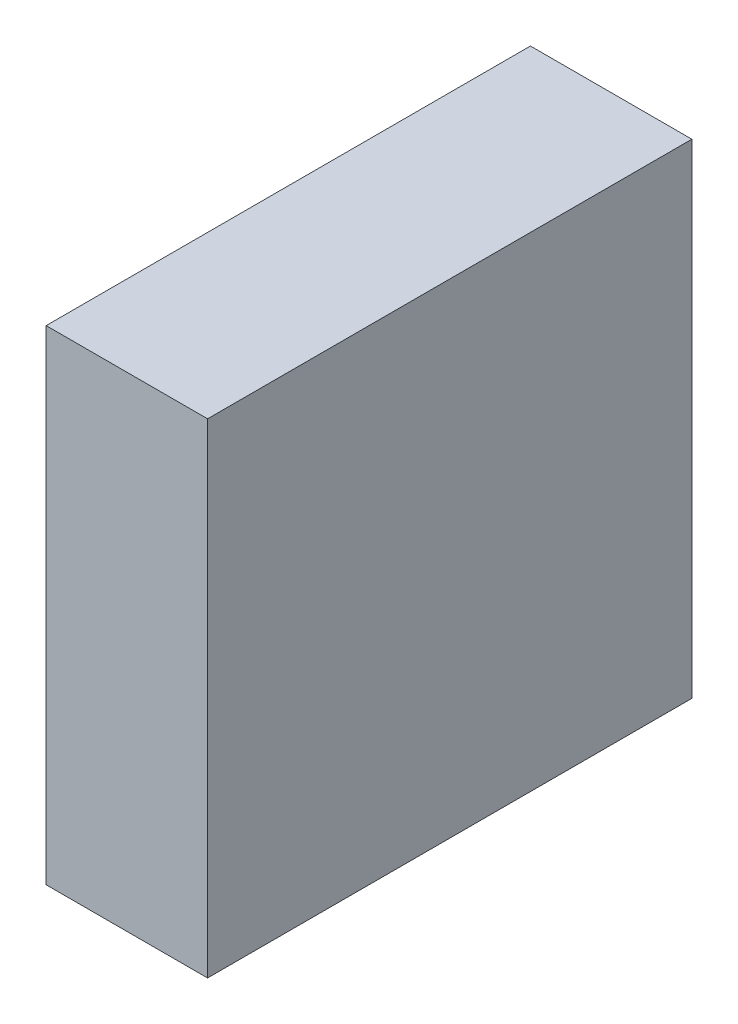
from build123d import *

# Parameters (mm, degrees)
SKETCH1_W           = 20
SKETCH1_H           = 60
BOSS_EXTRUDE1_DEPTH = 30


with BuildPart() as part:
    # Sketch1 → Boss-Extrude1 (new, symmetric)
    with BuildSketch(Plane.XY):
        Rectangle(SKETCH1_W, SKETCH1_H)
    extrude(amount=BOSS_EXTRUDE1_DEPTH, both=True)


solid = part.part
